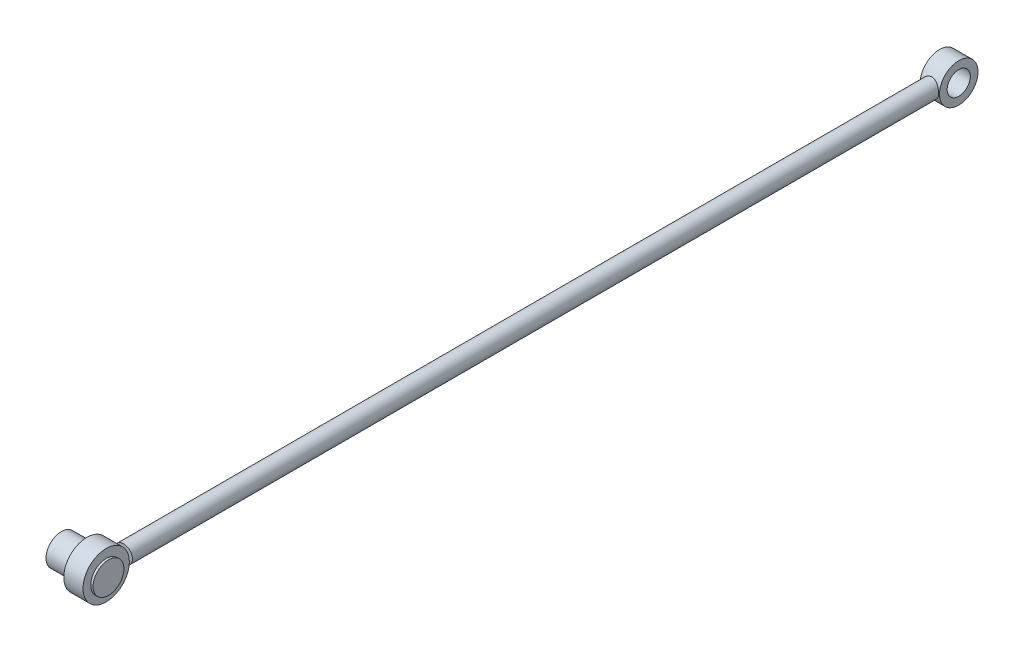
from build123d import *

# Parameters (mm, degrees)
SKETCH1_R           = 1.15
BOSS_EXTRUDE1_DEPTH = 52.5
SKETCH2_W           = 2.5
SKETCH2_H           = 1
SKETCH6_W           = 2.5
SKETCH6_H           = 3
SKETCH8_R           = 2
BOSS_EXTRUDE3_DEPTH = 3.3
SKETCH12_R          = 2
BOSS_EXTRUDE4_DEPTH = 0.3


with BuildPart() as part:
    # Sketch1 → Boss-Extrude1 (new, symmetric)
    with BuildSketch(Plane.XY):
        Circle(SKETCH1_R)
    extrude(amount=BOSS_EXTRUDE1_DEPTH, both=True)

    # Sketch2 → Revolve1 (revolve)
    with BuildSketch(Plane(origin=(0, 0, 0), x_dir=(1, 0, 0), z_dir=(0, 1, 0))):
        with Locations((0, 52.5)):
            Rectangle(SKETCH2_W, SKETCH2_H)
    revolve(axis=Axis((-2.676590035, 0, -54.5), (1, 0, 0)))


with BuildPart() as body_2:
    # Sketch6 → Revolve2 (revolve)
    with BuildSketch(Plane(origin=(0, 0, 0), x_dir=(1, 0, 0), z_dir=(0, 1, 0)), mode=Mode.PRIVATE) as revolve2_sk:
        with Locations((0, -54.5)):
            Rectangle(SKETCH6_W, SKETCH6_H)
    revolve(revolve2_sk.sketch.rotate(Axis((-1.25, 0, 56), (1, 0, 0)), 180), axis=Axis((-1.25, 0, 56), (1, 0, 0)))

    # Sketch8 → Boss-Extrude3 (add)
    with BuildSketch(Plane.ZY.offset(1.25)):
        with Locations((56, 0)):
            Circle(SKETCH8_R)
    extrude(amount=BOSS_EXTRUDE3_DEPTH)

    # Sketch12 → Boss-Extrude4 (add)
    with BuildSketch(Plane(origin=(1.25, 0, 0), x_dir=(0, 0, -1), z_dir=(1, 0, 0))):
        with Locations((-56, -0.12814495)):
            Circle(SKETCH12_R)
    extrude(amount=BOSS_EXTRUDE4_DEPTH)


solid = Compound([part.part, body_2.part])
